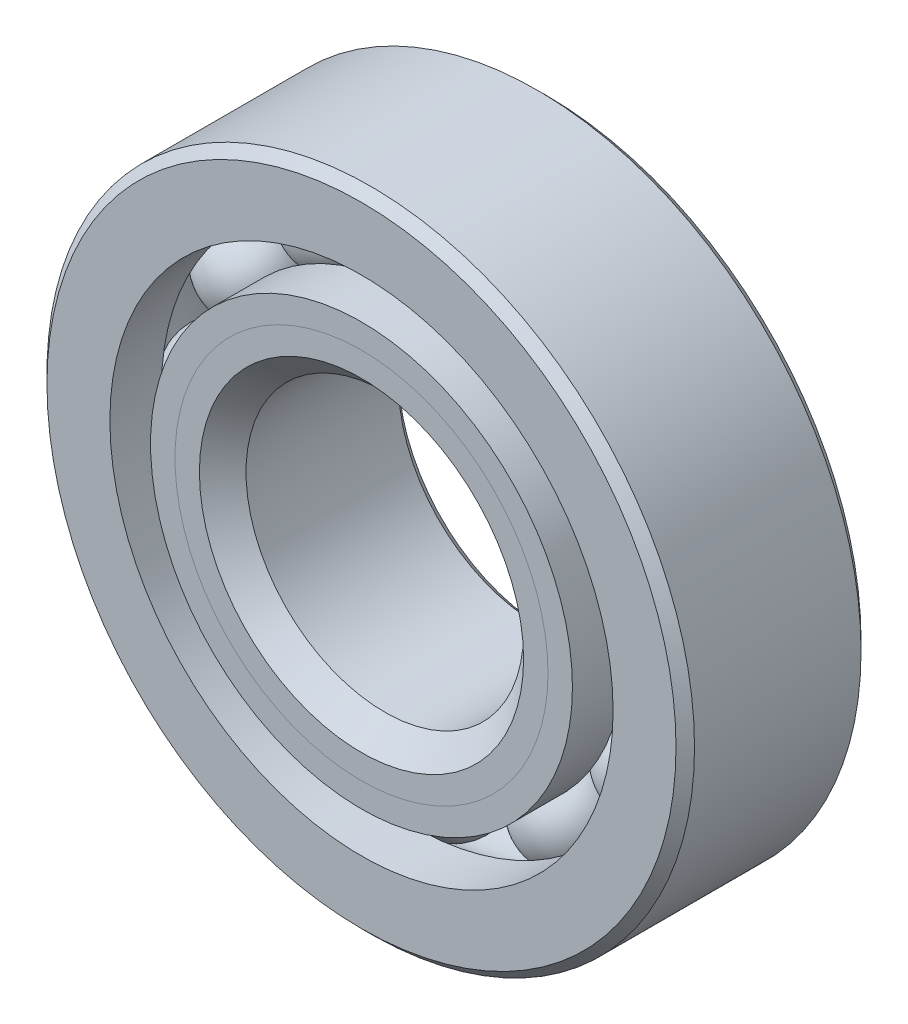
from build123d import *

# Parameters (mm, degrees)
CIRPATTERN1_COUNT = 12


with BuildPart() as part:
    # Sketch1 → Revolve1 (revolve)
    with BuildSketch(Plane(origin=(0, 0, 0), x_dir=(0, 0, -1), z_dir=(1, 0, 0))):
        with BuildLine():
            Line((3.6, 14), (-3.6, 14))
            Line((-3.6, 14), (-4, 13.6))
            Line((-4, 13.6), (-4, 10.879120879))
            Line((-4, 10.879120879), (-1.777777778, 10.879120879))
            ThreePointArc((-1.777777778, 10.879120879), (0, 11.983266837), (1.777777778, 10.879120879))
            Line((1.777777778, 10.879120879), (4, 10.879120879))
            Line((4, 10.879120879), (4, 13.6))
            Line((4, 13.6), (3.6, 14))
        make_face()
    revolve(axis=Axis((0, 0, 4), (0, 0, -1)))


with BuildPart() as body_2:
    # Sketch2 → Revolve2 (revolve)
    with BuildSketch(Plane(origin=(0, 0, 0), x_dir=(0, 0, -1), z_dir=(1, 0, 0))):
        with BuildLine():
            Line((-4, 9.120879121), (-1.777777778, 9.120879121))
            ThreePointArc((-1.777777778, 9.120879121), (-1.046378531, 8.315233157), (0, 8.016733163))
            Line((0, 8.016733163), (0, 7.008366581))
            Line((0, 7.008366581), (-2.94374373, 7.008366581))
            Line((-2.94374373, 7.008366581), (-4, 8.064622851))
            Line((-4, 8.064622851), (-4, 9.120879121))
        make_face()
    revolve(axis=Axis((0, 0, 4), (0, 0, -1)))


with BuildPart() as body_3:
    # Sketch3 → Revolve3 (revolve)
    with BuildSketch(Plane(origin=(0, 0, 0), x_dir=(0, 0, -1), z_dir=(1, 0, 0))):
        with BuildLine():
            Line((-4, 8.064622851), (-2.94374373, 7.008366581))
            Line((-2.94374373, 7.008366581), (0, 7.008366581))
            Line((0, 7.008366581), (0, 8.016733163))
            ThreePointArc((0, 8.016733163), (1.046378531, 8.315233157), (1.777777778, 9.120879121))
            Line((1.777777778, 9.120879121), (4, 9.120879121))
            Line((4, 9.120879121), (4, 6.4))
            Line((4, 6.4), (3.6, 6))
            Line((3.6, 6), (-2.991633419, 6))
            Line((-2.991633419, 6), (-4, 7.008366581))
            Line((-4, 7.008366581), (-4, 8.064622851))
        make_face()
    revolve(axis=Axis((0, 0, 4), (0, 0, -1)))


with BuildPart() as body_4:
    # Sketch4 → Revolve4 (revolve)
    with BuildSketch(Plane(origin=(0, 0, 0), x_dir=(0, 0, -1), z_dir=(1, 0, 0))):
        with BuildLine():
            Line((-1.983266837, 10), (1.983266837, 10))
            ThreePointArc((1.983266837, 10), (0, 11.983266837), (-1.983266837, 10))
        make_face()
    revolve(axis=Axis((0, 10, 1.983266837), (0, 0, -1)))


with BuildPart() as cirpattern1_1:
    # CirPattern1: pattern copy
    add(body_4.part.rotate(Axis((0, 0, -4), (0, 0, 1)), 1 * 360 / CIRPATTERN1_COUNT))


with BuildPart() as cirpattern1_2:
    # CirPattern1: pattern copy
    add(body_4.part.rotate(Axis((0, 0, -4), (0, 0, 1)), 2 * 360 / CIRPATTERN1_COUNT))


with BuildPart() as cirpattern1_3:
    # CirPattern1: pattern copy
    add(body_4.part.rotate(Axis((0, 0, -4), (0, 0, 1)), 3 * 360 / CIRPATTERN1_COUNT))


with BuildPart() as cirpattern1_4:
    # CirPattern1: pattern copy
    add(body_4.part.rotate(Axis((0, 0, -4), (0, 0, 1)), 4 * 360 / CIRPATTERN1_COUNT))


with BuildPart() as cirpattern1_5:
    # CirPattern1: pattern copy
    add(body_4.part.rotate(Axis((0, 0, -4), (0, 0, 1)), 5 * 360 / CIRPATTERN1_COUNT))


with BuildPart() as cirpattern1_6:
    # CirPattern1: pattern copy
    add(body_4.part.rotate(Axis((0, 0, -4), (0, 0, 1)), 6 * 360 / CIRPATTERN1_COUNT))


with BuildPart() as cirpattern1_7:
    # CirPattern1: pattern copy
    add(body_4.part.rotate(Axis((0, 0, -4), (0, 0, 1)), 7 * 360 / CIRPATTERN1_COUNT))


with BuildPart() as cirpattern1_8:
    # CirPattern1: pattern copy
    add(body_4.part.rotate(Axis((0, 0, -4), (0, 0, 1)), 8 * 360 / CIRPATTERN1_COUNT))


with BuildPart() as cirpattern1_9:
    # CirPattern1: pattern copy
    add(body_4.part.rotate(Axis((0, 0, -4), (0, 0, 1)), 9 * 360 / CIRPATTERN1_COUNT))


with BuildPart() as cirpattern1_10:
    # CirPattern1: pattern copy
    add(body_4.part.rotate(Axis((0, 0, -4), (0, 0, 1)), 10 * 360 / CIRPATTERN1_COUNT))


with BuildPart() as cirpattern1_11:
    # CirPattern1: pattern copy
    add(body_4.part.rotate(Axis((0, 0, -4), (0, 0, 1)), 11 * 360 / CIRPATTERN1_COUNT))


solid = Compound([part.part, body_2.part, body_3.part, body_4.part, cirpattern1_1.part, cirpattern1_2.part, cirpattern1_3.part, cirpattern1_4.part, cirpattern1_5.part, cirpattern1_6.part, cirpattern1_7.part, cirpattern1_8.part, cirpattern1_9.part, cirpattern1_10.part, cirpattern1_11.part])
